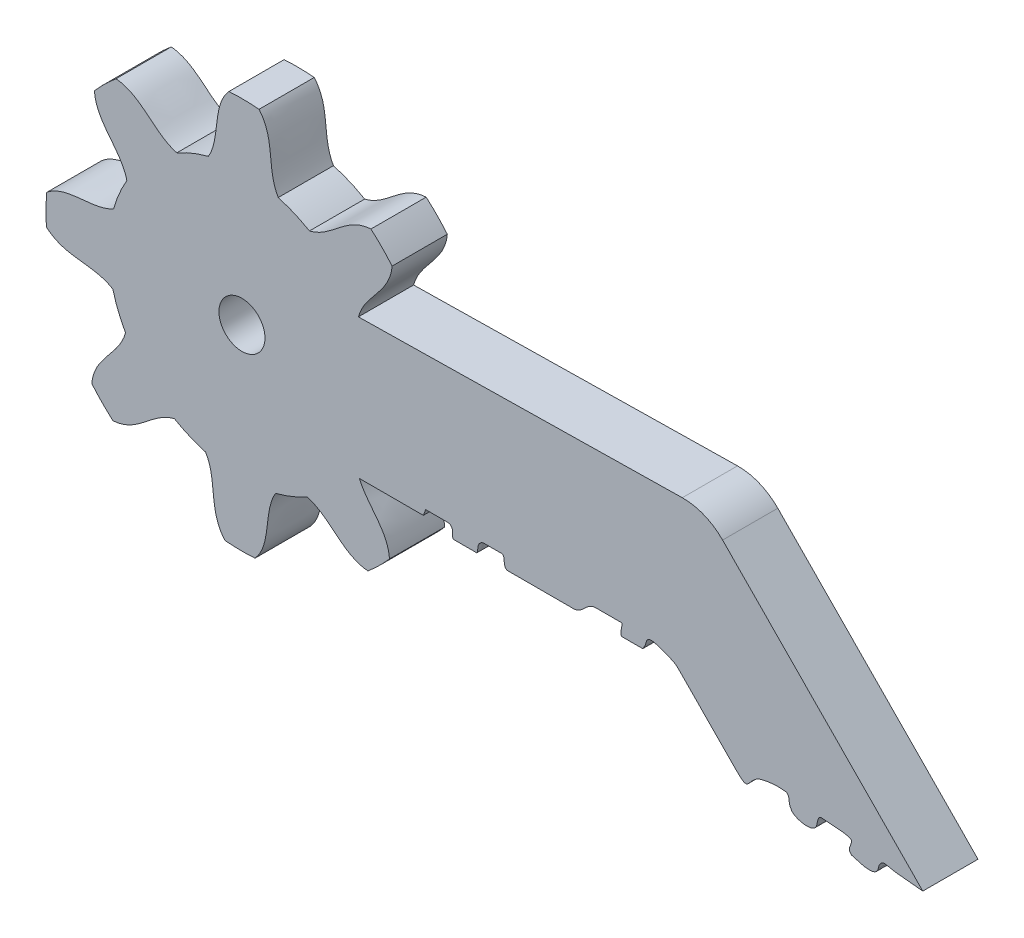
from build123d import *

# Parameters (mm, degrees)
ESQUISSE1_R        = 1.25
BOSS_EXTRU_1_DEPTH = 3
CONG_1_R           = 3


with BuildPart() as part:
    # Esquisse1 → Boss.-Extru.1 (new body)
    with BuildSketch(Plane.XY):
        with BuildLine():
            Line((-3.734627807, -4.485196705), (-2.769705324, -4.485196705))
            add(Edge.make_bspline(
                [(-2.769705324, -4.485196705), (-2.57713545, -4.485196705), (-2.331722683, -4.468616958), (-2.248675506, -4.80760679), (-2.277734979, -5.132246378), (-2.208021331, -5.132246378)],
                knots=[0, 0, 0, 0, 0.517236937, 0.847970255, 1, 1, 1, 1], degree=3))
            Line((-2.208021331, -5.132246378), (-0.975866285, -5.132246378))
            add(Edge.make_bspline(
                [(-0.975866285, -5.132246378), (-0.897142439, -5.132246378), (-0.949613424, -4.698776801), (-0.728030816, -4.485196705), (-0.540596518, -4.485196705)],
                knots=[0, 0, 0, 0, 0.38684992, 1, 1, 1, 1], degree=3))
            Line((-0.540596518, -4.485196705), (0.393324576, -4.485196705))
            add(Edge.make_bspline(
                [(0.393324576, -4.485196705), (0.638910479, -4.485196705), (0.398984004, -5.143340875), (0.7603007, -5.132246378)],
                knots=[0, 0, 0, 0, 0.869021917, 0.869021917, 0.869021917, 0.869021917], degree=3))
            Line((0.7603007, -5.132246378), (4.291625391, -5.132246378))
            add(Edge.make_bspline(
                [(4.291625391, -5.132246378), (4.823763212, -5.132246378), (4.976277419, -4.485196705), (5.503594727, -4.485196705)],
                knots=[0, 0, 0, 0, 1, 1, 1, 1], degree=3))
            Line((5.503594727, -4.485196705), (6.877458786, -4.485196705))
            add(Edge.make_bspline(
                [(6.877458786, -4.485196705), (6.976617296, -4.485196705), (6.870761733, -4.817189959), (6.846729617, -5.132246378), (6.958669178, -5.132246378)],
                knots=[0, 0, 0, 0, 0.5260163, 1, 1, 1, 1], degree=3))
            Line((6.958669178, -5.132246378), (8.060481342, -5.132246378))
            ThreePointArc((8.060481342, -5.132246378), (8.187383408, -4.908704908), (8.272126679, -4.666025076))
            add(Edge.make_bspline(
                [(8.272126679, -4.666025076), (8.349210597, -4.35873446), (9.337071659, -4.762833371), (9.794300685, -4.903225807), (10.011337039, -5.124277403)],
                knots=[0, 0, 0, 0, 0.527261023, 1, 1, 1, 1], degree=3))
            Line((10.011337039, -5.124277403), (13.064705998, -8.234134663))
            add(Edge.make_bspline(
                [(13.064705998, -8.234134663), (13.490330286, -8.667633137), (13.785649393, -8.827393259), (14.075081613, -8.182351509), (14.510423485, -8.066488675)],
                knots=[0, 0, 0, 0, 0.460710551, 1, 1, 1, 1], degree=3))
            ThreePointArc((14.510423485, -8.066488675), (15.18174267, -7.955441853), (15.861909333, -7.974784957))
            add(Edge.make_bspline(
                [(15.861909333, -7.974784957), (16.10159294, -8.154242616), (15.935166999, -8.395947295), (16.124120253, -8.644016897)],
                knots=[0, 0, 0, 0, 1, 1, 1, 1], degree=3))
            add(Edge.make_bspline(
                [(16.124120253, -8.644016897), (16.184465972, -8.946078243), (17.706516579, -9.350598436), (17.523421123, -8.305406598), (17.746436003, -8.234134662)],
                knots=[0, 0, 0, 0, 0.705660207, 1, 1, 1, 1], degree=3))
            add(Edge.make_bspline(
                [(17.746436003, -8.234134662), (17.783919067, -8.222155683), (18.785606441, -8.326082656), (19.079369937, -8.321210362), (19.357960566, -8.445407054)],
                knots=[0, 0, 0, 0, 0.477700623, 1, 1, 1, 1], degree=3))
            add(Edge.make_bspline(
                [(19.357960566, -8.445407054), (19.512936477, -8.514495866), (19.148661951, -8.951431635), (19.367327137, -9.124426979), (19.427044979, -9.183191482)],
                knots=[0, 0, 0, 0, 0.680948688, 1, 1, 1, 1], degree=3))
            add(Edge.make_bspline(
                [(19.427044979, -9.183191482), (19.377364949, -9.134304547), (20.010743736, -9.420516174), (20.787073768, -9.422210975), (20.854615402, -9.085328222)],
                knots=[0, 0, 0, 0, 0.494582685, 1, 1, 1, 1], degree=3))
            add(Edge.make_bspline(
                [(20.854615402, -9.085328222), (20.889698828, -8.91033984), (21.090420582, -8.529024737), (21.485069525, -8.7550575), (21.911052326, -8.797112462)],
                knots=[0, 0, 0, 0, 0.363922375, 1, 1, 1, 1], degree=3))
            Line((21.911052326, -8.797112462), (23.279849729, -8.932246377))
            Line((23.279849729, -8.932246377), (11.497821027, 3.067753623))
            Line((11.497821027, 3.067753623), (-7.392604605, 2.756774088))
            add(Edge.make_bspline(
                [(-7.392604605, 2.756774088), (-7.058502345, 4.013413813), (-5.676898196, 4.66345538), (-5.560782906, 6.062256835)],
                knots=[0, 0, 0, 0, 1, 1, 1, 1], degree=3))
            ThreePointArc((-5.560782906, 6.062256835), (-6.112383098, 6.67056374), (-6.709211686, 7.234563473))
            add(Edge.make_bspline(
                [(-6.709211686, 7.234563473), (-8.110106161, 7.147254026), (-8.78843753, 5.779317398), (-10.051685597, 5.47114206)],
                knots=[0, 0, 0, 0, 1, 1, 1, 1], degree=3))
            ThreePointArc((-10.051685597, 5.47114206), (-10.876929396, 5.886981094), (-11.748365191, 6.194469441))
            add(Edge.make_bspline(
                [(-11.748365191, 6.194469441), (-12.400697689, 7.319293885), (-11.883404826, 8.755884348), (-12.790400912, 9.827092251)],
                knots=[0, 0, 0, 0, 1, 1, 1, 1], degree=3))
            ThreePointArc((-12.790400912, 9.827092251), (-13.610579085, 9.867189954), (-14.431408663, 9.843976447))
            add(Edge.make_bspline(
                [(-14.431408663, 9.843976447), (-15.360253545, 8.791657362), (-14.872628989, 7.344727385), (-15.547967393, 6.233563239)],
                knots=[0, 0, 0, 0, 1, 1, 1, 1], degree=3))
            ThreePointArc((-15.547967393, 6.233563239), (-16.42554548, 5.944070354), (-17.259170735, 5.545299289))
            add(Edge.make_bspline(
                [(-17.259170735, 5.545299289), (-18.51581046, 5.879401549), (-19.165852027, 7.261005698), (-20.564653482, 7.377120988)],
                knots=[0, 0, 0, 0, 1, 1, 1, 1], degree=3))
            ThreePointArc((-20.564653482, 7.377120988), (-21.172960388, 6.825520796), (-21.73696012, 6.228692208))
            add(Edge.make_bspline(
                [(-21.73696012, 6.228692208), (-21.649650674, 4.827797732), (-20.281714046, 4.149466364), (-19.973538707, 2.886218296)],
                knots=[0, 0, 0, 0, 1, 1, 1, 1], degree=3))
            ThreePointArc((-19.973538707, 2.886218296), (-20.389377741, 2.060974498), (-20.696866088, 1.189538702))
            add(Edge.make_bspline(
                [(-20.696866088, 1.189538702), (-21.821690533, 0.537206205), (-23.258280996, 1.054499067), (-24.329488899, 0.147502982)],
                knots=[0, 0, 0, 0, 1, 1, 1, 1], degree=3))
            ThreePointArc((-24.329488899, 0.147502982), (-24.369586601, -0.672675192), (-24.346373094, -1.493504769))
            add(Edge.make_bspline(
                [(-24.346373094, -1.493504769), (-23.29405401, -2.422349651), (-21.847124033, -1.934725096), (-20.735959887, -2.610063499)],
                knots=[0, 0, 0, 0, 1, 1, 1, 1], degree=3))
            ThreePointArc((-20.735959887, -2.610063499), (-20.446467002, -3.487641586), (-20.047695936, -4.321266841))
            add(Edge.make_bspline(
                [(-20.047695936, -4.321266841), (-20.381798196, -5.577906566), (-21.763402345, -6.227948133), (-21.879517635, -7.626749588)],
                knots=[0, 0, 0, 0, 1, 1, 1, 1], degree=3))
            ThreePointArc((-21.879517635, -7.626749588), (-21.327917444, -8.235056494), (-20.731088855, -8.799056226))
            add(Edge.make_bspline(
                [(-20.731088855, -8.799056226), (-19.33019438, -8.71174678), (-18.651863011, -7.343810152), (-17.388614944, -7.035634814)],
                knots=[0, 0, 0, 0, 1, 1, 1, 1], degree=3))
            ThreePointArc((-17.388614944, -7.035634814), (-16.563371146, -7.451473848), (-15.69193535, -7.758962195))
            add(Edge.make_bspline(
                [(-15.69193535, -7.758962195), (-15.039602853, -8.883786639), (-15.556895715, -10.320377102), (-14.64989963, -11.391585005)],
                knots=[0, 0, 0, 0, 1, 1, 1, 1], degree=3))
            ThreePointArc((-14.64989963, -11.391585005), (-13.829721456, -11.431682707), (-13.008891878, -11.408469201))
            add(Edge.make_bspline(
                [(-13.008891878, -11.408469201), (-12.080046997, -10.356150116), (-12.567671552, -8.909220139), (-11.892333149, -7.798055993)],
                knots=[0, 0, 0, 0, 1, 1, 1, 1], degree=3))
            ThreePointArc((-11.892333149, -7.798055993), (-11.014755062, -7.508563108), (-10.181129806, -7.109792043))
            add(Edge.make_bspline(
                [(-10.181129806, -7.109792043), (-8.924490081, -7.443894302), (-8.274448514, -8.825498451), (-6.875647059, -8.941613741)],
                knots=[0, 0, 0, 0, 1, 1, 1, 1], degree=3))
            ThreePointArc((-6.875647059, -8.941613741), (-6.267340154, -8.39001355), (-5.703340421, -7.793184961))
            add(Edge.make_bspline(
                [(-5.703340421, -7.793184961), (-5.781757205, -6.534974722), (-6.893216754, -5.859634034), (-7.342088148, -4.819882898)],
                knots=[0, 0, 0, 0, 0.898147763, 0.898147763, 0.898147763, 0.898147763], degree=3))
            Line((-7.342088148, -4.819882898), (-3.865202715, -4.819882898))
            Line((-3.865202715, -4.819882898), (-3.734627807, -4.485196705))
        make_face()
        with Locations((-13.720150271, -0.782246377)):
            Circle(ESQUISSE1_R, mode=Mode.SUBTRACT)
    extrude(amount=BOSS_EXTRU_1_DEPTH)

    # Congé1
    cong_1_edges = [part.edges().sort_by_distance(p)[0] for p in [
        (11.497821027, 3.067753623, 1.5),
    ]]
    fillet(cong_1_edges, radius=CONG_1_R)


solid = part.part
